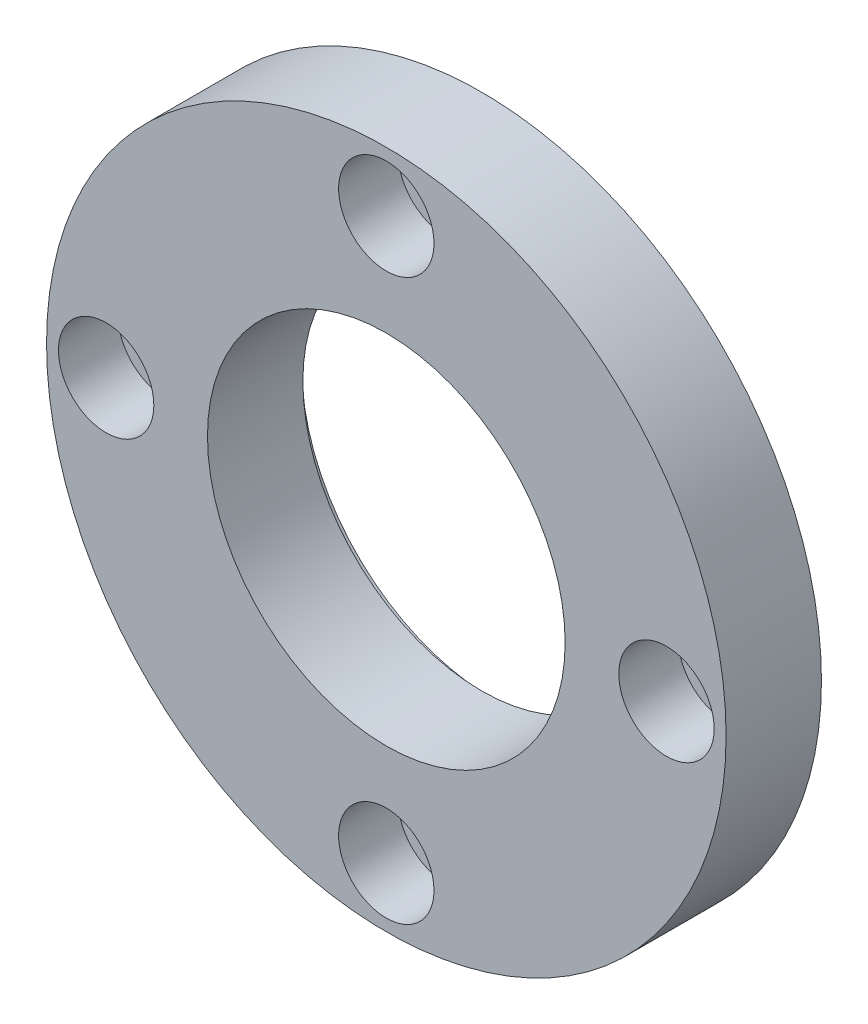
from build123d import *

# Parameters (mm, degrees)
SKETCH_1_R          = 28.5
SKETCH_1_R_2        = 15
EXTRUDE_1_DEPTH     = 8
SKETCH_2_R          = 18.4
SKETCH_2_R_2        = 16.1
EXTRUDE_2_DEPTH     = 1
SKETCH_3_R          = 4
CUT_EXTRUDE_1_DEPTH = 5
SKETCH_4_R          = 2.25
CUT_EXTRUDE_2_DEPTH = 42.297699694


with BuildPart() as part:
    # 草图1 → 拉伸1 (new body)
    with BuildSketch(Plane.XY):
        Circle(SKETCH_1_R)
        Circle(SKETCH_1_R_2, mode=Mode.SUBTRACT)
    extrude(amount=EXTRUDE_1_DEPTH)

    # 草图2 → 拉伸2 (add)
    with BuildSketch(Plane(origin=(0, 0, 0), x_dir=(-1, 0, 0), z_dir=(0, 0, -1))):
        with Locations(Location((0, 0, 0), (0, 0, 180))):
            Circle(SKETCH_2_R)
        Circle(SKETCH_2_R_2, mode=Mode.SUBTRACT)
    extrude(amount=EXTRUDE_2_DEPTH)

    # 草图3 → 切除-拉伸1 (cut)
    with BuildSketch(Plane.XY.offset(8)):
        with Locations((0, 23.5)):
            Circle(SKETCH_3_R)
        with Locations((-23.5, 0)):
            Circle(SKETCH_3_R)
        with Locations((0, -23.5)):
            Circle(SKETCH_3_R)
        with Locations((23.5, 0)):
            Circle(SKETCH_3_R)
    extrude(amount=-CUT_EXTRUDE_1_DEPTH, mode=Mode.SUBTRACT)

    # 草图4 → 切除-拉伸2 (cut, through all)
    with BuildSketch(Plane.XY.offset(8)):
        with Locations((-23.5, 0)):
            Circle(SKETCH_4_R)
        with Locations((0, 23.5)):
            Circle(SKETCH_4_R)
        with Locations((23.5, 0)):
            Circle(SKETCH_4_R)
        with Locations((0, -23.5)):
            Circle(SKETCH_4_R)
    extrude(amount=-CUT_EXTRUDE_2_DEPTH, mode=Mode.SUBTRACT)


solid = part.part
